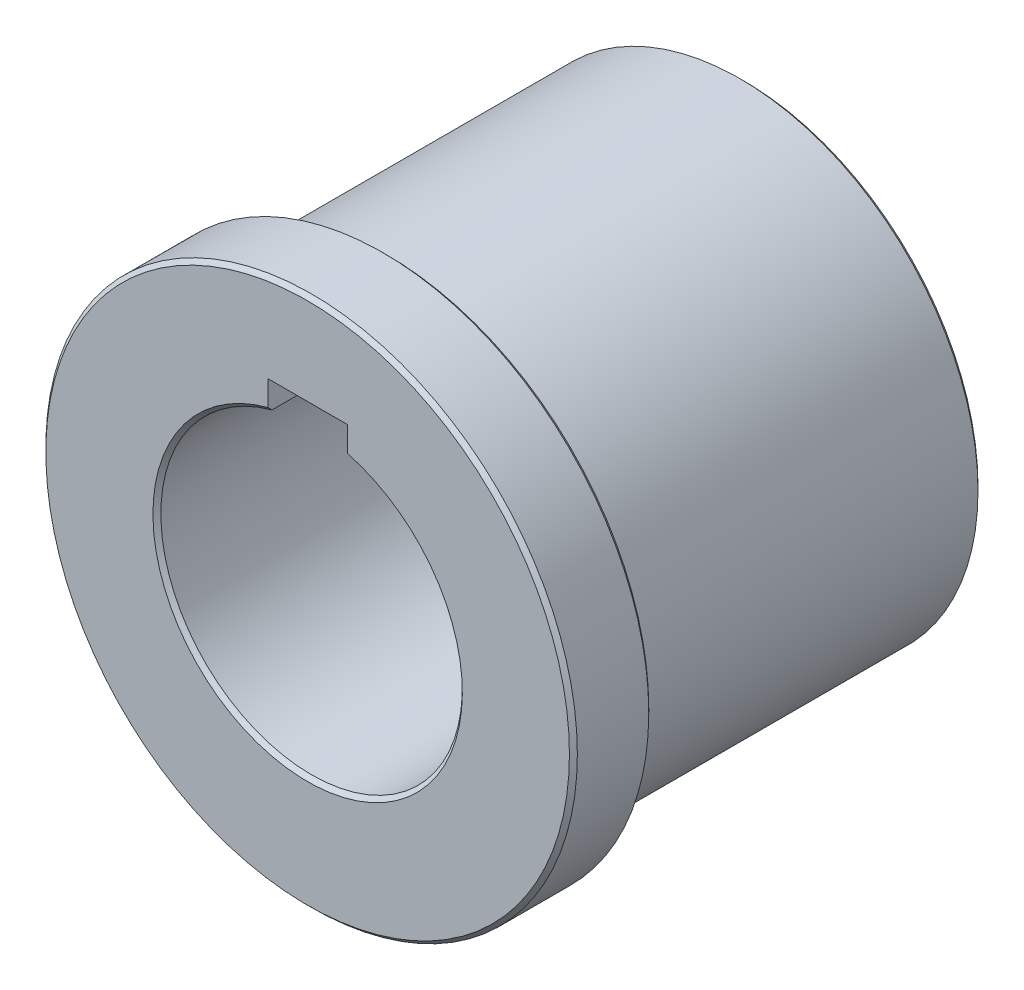
from build123d import *

# Parameters (mm, degrees)
SKETCH_1_R          = 30
SKETCH_1_R_2        = 19
EXTRUDE_1_DEPTH     = 55
CUT_EXTRUDE_1_DEPTH = 70.462219947
SKETCH_3_R          = 33.5
SKETCH_3_R_2        = 27.5
EXTRUDE_2_DEPTH     = 10
SKETCH_4_R          = 2.5
CUT_EXTRUDE_2_DEPTH = 34
CHAMFER_1_SIZE      = 0.5


with BuildPart() as part:
    # 草图1 → 拉伸1 (new body)
    with BuildSketch(Plane.XY):
        Circle(SKETCH_1_R)
        Circle(SKETCH_1_R_2, mode=Mode.SUBTRACT)
    extrude(amount=EXTRUDE_1_DEPTH)

    # 草图2 → 切除-拉伸1 (cut, through all)
    with BuildSketch(Plane.XY.offset(55)):
        with BuildLine():
            Line((5, 19), (5, 18.33030278))
            ThreePointArc((5, 18.33030278), (0, 19), (-5, 18.33030278))
            Line((-5, 18.33030278), (-5, 19))
            Line((-5, 19), (-5, 22))
            Line((-5, 22), (5, 22))
            Line((5, 22), (5, 19))
        make_face()
    extrude(amount=-CUT_EXTRUDE_1_DEPTH, mode=Mode.SUBTRACT)

    # 草图3 → 拉伸2 (add)
    with BuildSketch(Plane.XY.offset(55)):
        Circle(SKETCH_3_R)
        Circle(SKETCH_3_R_2, mode=Mode.SUBTRACT)
    extrude(amount=-EXTRUDE_2_DEPTH)

    # 草图4 → 切除-拉伸2 (cut)
    with BuildSketch(Plane(origin=(0, 0, 0), x_dir=(-1, 0, 0), z_dir=(0, 0, -1))):
        with Locations(Location((12.5, 21.650635095, 0), (0, 0, 90))):
            Circle(SKETCH_4_R)
        with Locations(Location((25, 0, 0), (0, 0, 90))):
            Circle(SKETCH_4_R)
        with Locations(Location((12.5, -21.650635095, 0), (0, 0, 90))):
            Circle(SKETCH_4_R)
        with Locations(Location((-12.5, -21.650635095, 0), (0, 0, 90))):
            Circle(SKETCH_4_R)
        with Locations(Location((-25, 0, 0), (0, 0, 90))):
            Circle(SKETCH_4_R)
        with Locations(Location((-12.5, 21.650635095, 0), (0, 0, 90))):
            Circle(SKETCH_4_R)
    extrude(amount=-CUT_EXTRUDE_2_DEPTH, mode=Mode.SUBTRACT)

    # 倒角1
    chamfer_1_edges = [part.edges().sort_by_distance(p)[0] for p in [
        (0, -19, 0),
        (-30, 0, 0),
        (-33.5, 0, 55),
        (-33.5, 0, 45),
        (0, -19, 55),
    ]]
    chamfer(chamfer_1_edges, length=CHAMFER_1_SIZE)


solid = part.part
